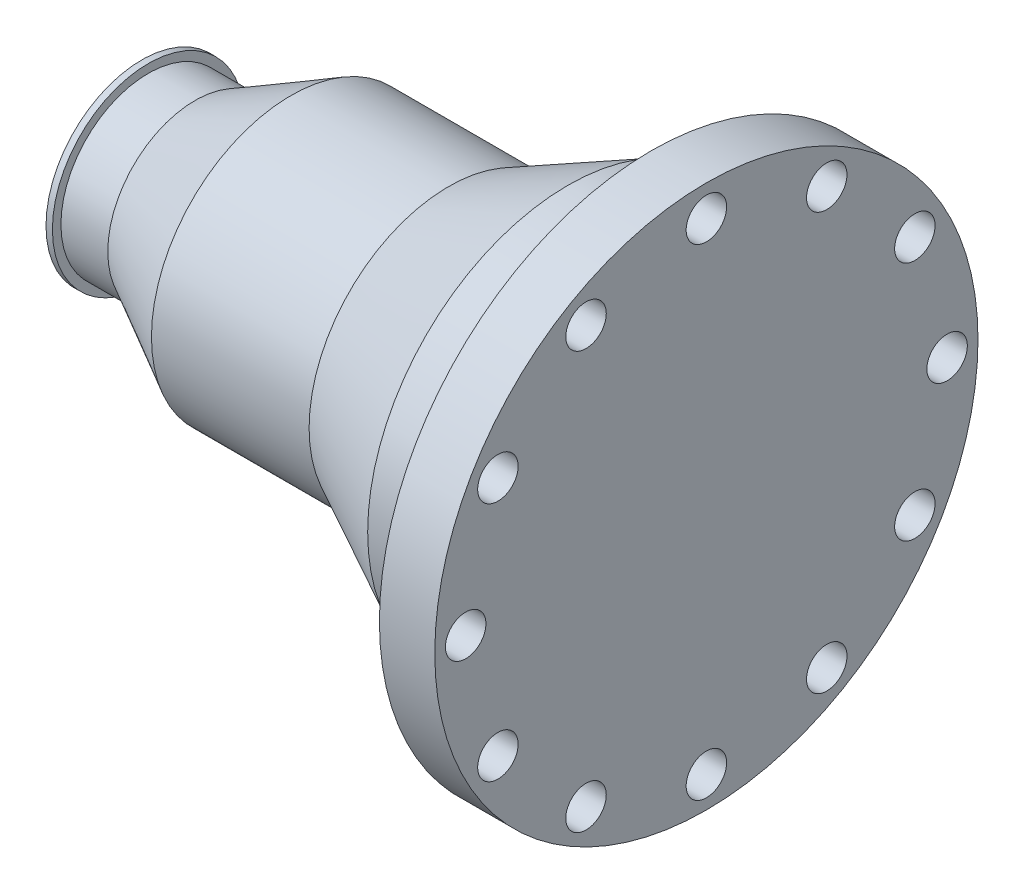
from build123d import *

# Parameters (mm, degrees)
SKETCH_3_R           = 9.5
CUT_EXTRUDE_1_DEPTH  = 321.526909947
SKETCH_4_R           = 9.5
CUT_EXTRUDE_2_DEPTH  = 321.526909947
SKETCH_5_R           = 9.5
CUT_EXTRUDE_3_DEPTH  = 321.526909947
SKETCH_6_R           = 9.5
CUT_EXTRUDE_4_DEPTH  = 321.526909947
SKETCH_7_R           = 9.5
CUT_EXTRUDE_5_DEPTH  = 321.526909947
SKETCH_8_R           = 9.5
CUT_EXTRUDE_6_DEPTH  = 321.526909947
SKETCH_9_R           = 9.5
CUT_EXTRUDE_7_DEPTH  = 321.526909947
SKETCH_10_R          = 9.5
CUT_EXTRUDE_8_DEPTH  = 321.526909947
SKETCH_11_R          = 9.5
CUT_EXTRUDE_9_DEPTH  = 321.526909947
SKETCH_12_R          = 9.5
CUT_EXTRUDE_10_DEPTH = 321.526909947
SKETCH_13_R          = 9.5
CUT_EXTRUDE_11_DEPTH = 321.526909947
SKETCH_14_R          = 9.5
CUT_EXTRUDE_12_DEPTH = 321.526909947


with BuildPart() as part:
    # Эскиз1 → Повернуть1 (revolve)
    with BuildSketch(Plane.XY, mode=Mode.PRIVATE) as revolve_1_sk:
        Polygon((0, 0), (265, 0), (265, 127.5), (239, 127.5), (239, 100), (239, 95), (220, 95), (220, 94), (200, 94), (144, 65.5), (70, 65.5), (25, 41), (3, 41), (3, 45), (0, 45), align=None)
    revolve(revolve_1_sk.sketch.rotate(Axis((0, 0, 0), (1, 0, 0)), 90), axis=Axis((0, 0, 0), (1, 0, 0)))

    # Эскиз2 → Вырез-Повернуть1 (revolve, cut)
    with BuildSketch(Plane.XY, mode=Mode.PRIVATE) as cut_revolve_1_sk:
        with BuildLine():
            Line((0, 0), (200, 0))
            Line((200, 0), (200, 55))
            Line((200, 55), (147.669872, 55))
            ThreePointArc((147.669872, 55), (146.273624348, 54.108499061), (146.669872, 52.5))
            Line((146.669872, 52.5), (143.5, 52.5))
            ThreePointArc((143.5, 52.5), (142.75, 52.602347572), (142, 52.5))
            Line((142, 52.5), (90, 52.5))
            ThreePointArc((90, 52.5), (79.13262933, 46.740617582), (70, 38.502577))
            Line((70, 38.502577), (42, 31))
            Line((42, 31), (0, 31))
            Line((0, 31), (0, 0))
        make_face()
    revolve(cut_revolve_1_sk.sketch.rotate(Axis((0, 0, 0), (1, 0, 0)), 90), axis=Axis((0, 0, 0), (1, 0, 0)), mode=Mode.SUBTRACT)

    # Эскиз3 → Вырез-Вытянуть1 (cut, through all)
    with BuildSketch(Plane(origin=(0, 0, 0), x_dir=(0, 0, -1), z_dir=(1, 0, 0))):
        with Locations((0, 113)):
            Circle(SKETCH_3_R)
    extrude(amount=CUT_EXTRUDE_1_DEPTH, mode=Mode.SUBTRACT)

    # Эскиз4 → Вырез-Вытянуть2 (cut, through all)
    with BuildSketch(Plane(origin=(0, 0, 0), x_dir=(0, 0, -1), z_dir=(1, 0, 0))):
        with Locations((-56.5, 97.860870628)):
            Circle(SKETCH_4_R)
    extrude(amount=CUT_EXTRUDE_2_DEPTH, mode=Mode.SUBTRACT)

    # Эскиз5 → Вырез-Вытянуть3 (cut, through all)
    with BuildSketch(Plane(origin=(0, 0, 0), x_dir=(0, 0, -1), z_dir=(1, 0, 0))):
        with Locations((-97.860870628, 56.5)):
            Circle(SKETCH_5_R)
    extrude(amount=CUT_EXTRUDE_3_DEPTH, mode=Mode.SUBTRACT)

    # Эскиз6 → Вырез-Вытянуть4 (cut, through all)
    with BuildSketch(Plane(origin=(0, 0, 0), x_dir=(0, 0, -1), z_dir=(1, 0, 0))):
        with Locations((-113, 0)):
            Circle(SKETCH_6_R)
    extrude(amount=CUT_EXTRUDE_4_DEPTH, mode=Mode.SUBTRACT)

    # Эскиз7 → Вырез-Вытянуть5 (cut, through all)
    with BuildSketch(Plane(origin=(0, 0, 0), x_dir=(0, 0, -1), z_dir=(1, 0, 0))):
        with Locations((-97.860870628, -56.5)):
            Circle(SKETCH_7_R)
    extrude(amount=CUT_EXTRUDE_5_DEPTH, mode=Mode.SUBTRACT)

    # Эскиз8 → Вырез-Вытянуть6 (cut, through all)
    with BuildSketch(Plane(origin=(0, 0, 0), x_dir=(0, 0, -1), z_dir=(1, 0, 0))):
        with Locations((-56.5, -97.860870628)):
            Circle(SKETCH_8_R)
    extrude(amount=CUT_EXTRUDE_6_DEPTH, mode=Mode.SUBTRACT)

    # Эскиз9 → Вырез-Вытянуть7 (cut, through all)
    with BuildSketch(Plane(origin=(0, 0, 0), x_dir=(0, 0, -1), z_dir=(1, 0, 0))):
        with Locations((0, -113)):
            Circle(SKETCH_9_R)
    extrude(amount=CUT_EXTRUDE_7_DEPTH, mode=Mode.SUBTRACT)

    # Эскиз10 → Вырез-Вытянуть8 (cut, through all)
    with BuildSketch(Plane(origin=(0, 0, 0), x_dir=(0, 0, -1), z_dir=(1, 0, 0))):
        with Locations((56.5, -97.860870628)):
            Circle(SKETCH_10_R)
    extrude(amount=CUT_EXTRUDE_8_DEPTH, mode=Mode.SUBTRACT)

    # Эскиз11 → Вырез-Вытянуть9 (cut, through all)
    with BuildSketch(Plane(origin=(0, 0, 0), x_dir=(0, 0, -1), z_dir=(1, 0, 0))):
        with Locations((97.860870628, -56.5)):
            Circle(SKETCH_11_R)
    extrude(amount=CUT_EXTRUDE_9_DEPTH, mode=Mode.SUBTRACT)

    # Эскиз12 → Вырез-Вытянуть10 (cut, through all)
    with BuildSketch(Plane(origin=(0, 0, 0), x_dir=(0, 0, -1), z_dir=(1, 0, 0))):
        with Locations((113, 0)):
            Circle(SKETCH_12_R)
    extrude(amount=CUT_EXTRUDE_10_DEPTH, mode=Mode.SUBTRACT)

    # Эскиз13 → Вырез-Вытянуть11 (cut, through all)
    with BuildSketch(Plane(origin=(0, 0, 0), x_dir=(0, 0, -1), z_dir=(1, 0, 0))):
        with Locations((97.860870628, 56.5)):
            Circle(SKETCH_13_R)
    extrude(amount=CUT_EXTRUDE_11_DEPTH, mode=Mode.SUBTRACT)

    # Эскиз14 → Вырез-Вытянуть12 (cut, through all)
    with BuildSketch(Plane(origin=(0, 0, 0), x_dir=(0, 0, -1), z_dir=(1, 0, 0))):
        with Locations((56.5, 97.860870628)):
            Circle(SKETCH_14_R)
    extrude(amount=CUT_EXTRUDE_12_DEPTH, mode=Mode.SUBTRACT)


solid = part.part
